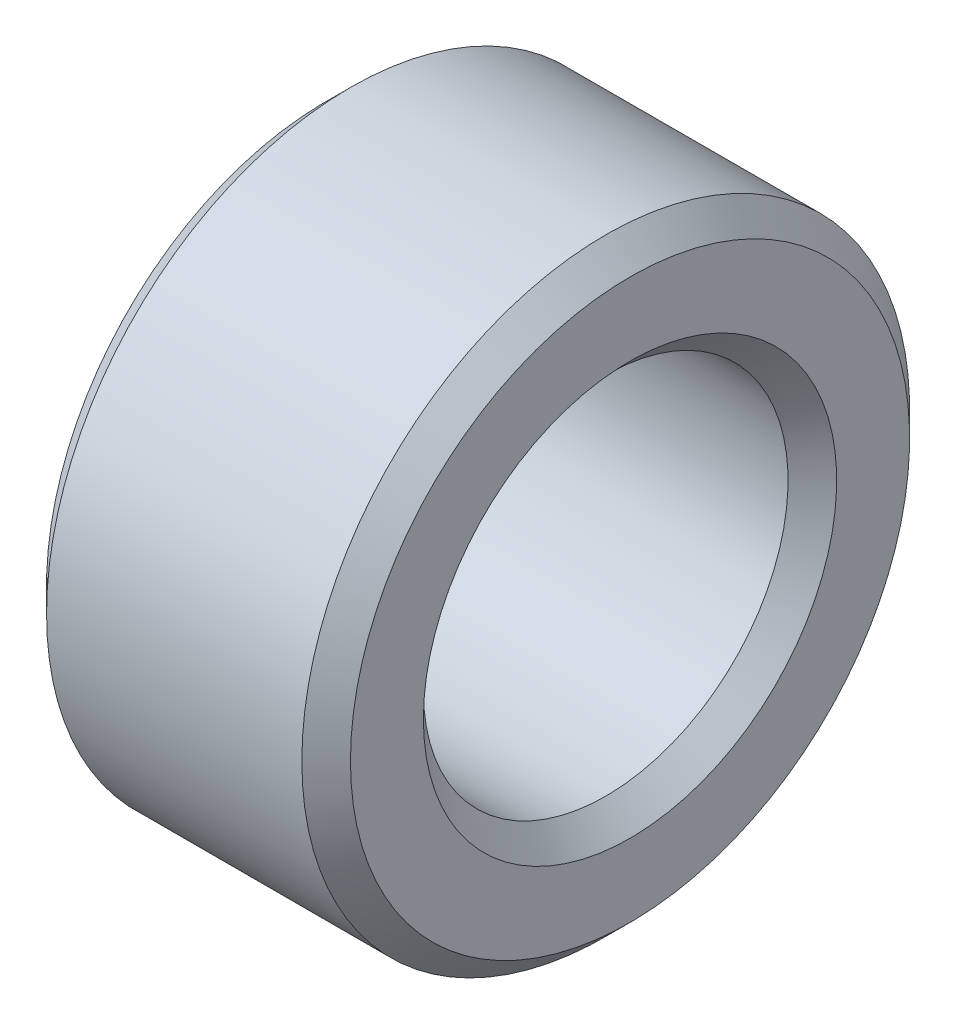
from build123d import *

# Parameters (mm, degrees)
SKETCH1_W     = 2.5
SKETCH1_H     = 1
CHAMFER1_SIZE = 0.2


with BuildPart() as part:
    # Sketch1 → Revolve1 (revolve)
    with BuildSketch(Plane.XY, mode=Mode.PRIVATE) as revolve1_sk:
        with Locations((1.25, 2)):
            Rectangle(SKETCH1_W, SKETCH1_H)
    revolve(revolve1_sk.sketch.rotate(Axis((0, 0, 0), (1, 0, 0)), 90), axis=Axis((0, 0, 0), (1, 0, 0)))

    # Chamfer1
    chamfer1_edges = [part.edges().sort_by_distance(p)[0] for p in [
        (0, 0, -1.5),
        (2.5, 0, -1.5),
        (2.5, 0, -2.5),
        (0, 0, -2.5),
    ]]
    chamfer(chamfer1_edges, length=CHAMFER1_SIZE)


solid = part.part
